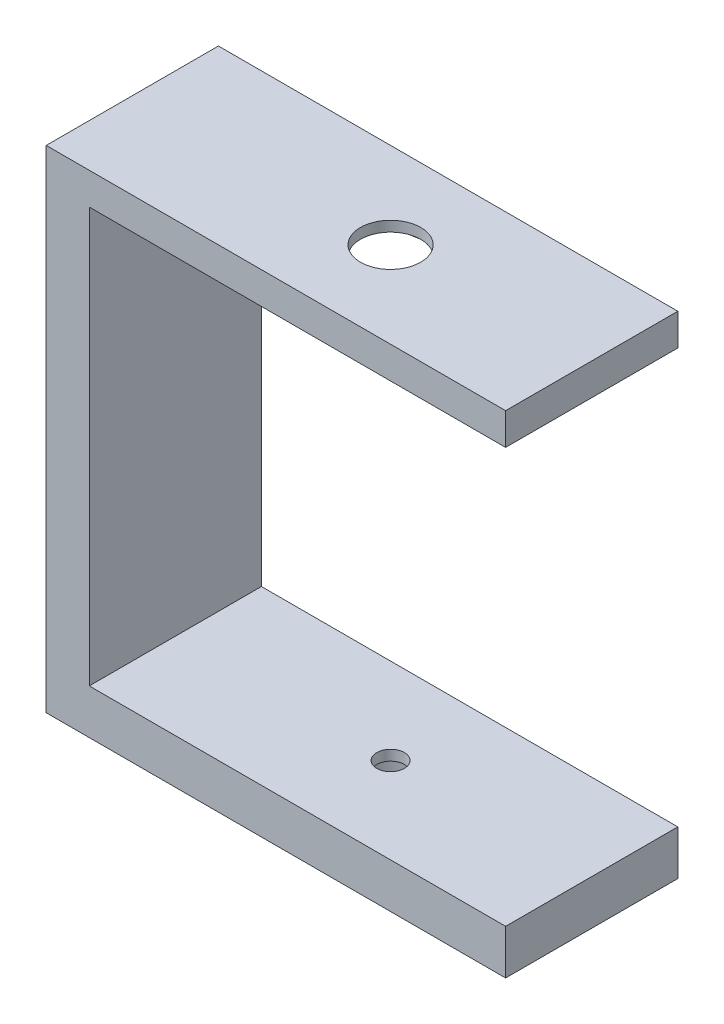
from build123d import *

# Parameters (mm, degrees)
CROQUIS1_W              = 53.36
CROQUIS1_H              = 20
SALIENTE_EXTRUIR1_DEPTH = 3.7
CROQUIS2_W              = 5
CROQUIS2_H              = 20
SALIENTE_EXTRUIR2_DEPTH = 48.17
CROQUIS3_W              = 53.36
CROQUIS3_H              = 20
SALIENTE_EXTRUIR3_DEPTH = 5.2
CORTAR_EXTRUIR1_DEPTH   = 2.5
CROQUIS5_R              = 3.5
CORTAR_EXTRUIR2_DEPTH   = 80.804426569
CROQUIS6_R              = 5
CORTAR_EXTRUIR3_DEPTH   = 4
CROQUIS7_R              = 1.6
CORTAR_EXTRUIR4_DEPTH   = 78.86985617


with BuildPart() as part:
    # Croquis1 → Saliente-Extruir1 (new body)
    with BuildSketch(Plane(origin=(0, 0, 0), x_dir=(1, 0, 0), z_dir=(0, 1, 0))):
        with Locations((26.68, 10)):
            Rectangle(CROQUIS1_W, CROQUIS1_H)
    extrude(amount=SALIENTE_EXTRUIR1_DEPTH)

    # Croquis2 → Saliente-Extruir2 (add)
    with BuildSketch(Plane.XZ):
        with Locations((2.5, -10)):
            Rectangle(CROQUIS2_W, CROQUIS2_H)
    extrude(amount=SALIENTE_EXTRUIR2_DEPTH)

    # Croquis3 → Saliente-Extruir3 (add)
    with BuildSketch(Plane.XZ.offset(48.17)):
        with Locations((26.68, -10)):
            Rectangle(CROQUIS3_W, CROQUIS3_H)
    extrude(amount=SALIENTE_EXTRUIR3_DEPTH)

    # Croquis4 → Cortar-Extruir1 (cut)
    with BuildSketch(Plane.XZ):
        with BuildLine():
            Line((28.897334072, -3.746470768), (13.839427952, -6.40158589))
            ThreePointArc((13.839427952, -6.40158589), (10.82, -10), (13.839427952, -13.59841411))
            Line((13.839427952, -13.59841411), (28.897334072, -16.253529232))
            ThreePointArc((28.897334072, -16.253529232), (29.446561034, -16.325836333), (30, -16.35))
            Line((30, -16.35), (30, -3.65))
            ThreePointArc((30, -3.65), (29.446561034, -3.674163667), (28.897334072, -3.746470768))
        make_face()
    cortar_extruir1 = extrude(amount=-CORTAR_EXTRUIR1_DEPTH, mode=Mode.SUBTRACT)

    # Simetría1: Cortar-Extruir1 across plane
    add(cortar_extruir1.mirror(Plane(origin=(30, 2.5, -3.65), x_dir=(0, 0, 1), z_dir=(1, 0, 0))), mode=Mode.SUBTRACT)

    # Croquis5 → Cortar-Extruir2 (cut, through all)
    with BuildSketch(Plane.XZ.offset(-2.5)):
        with Locations(Location((30, -10, 0), (0, 0, 270))):
            Circle(CROQUIS5_R)
    extrude(amount=-CORTAR_EXTRUIR2_DEPTH, mode=Mode.SUBTRACT)

    # Croquis6 → Cortar-Extruir3 (cut)
    with BuildSketch(Plane.XZ.offset(53.37)):
        with Locations(Location((30, -10, 0), (0, 0, 270))):
            Circle(CROQUIS6_R)
    extrude(amount=-CORTAR_EXTRUIR3_DEPTH, mode=Mode.SUBTRACT)

    # Croquis7 → Cortar-Extruir4 (cut, through all)
    with BuildSketch(Plane.XZ.offset(49.37)):
        with Locations(Location((30, -10, 0), (0, 0, 270))):
            Circle(CROQUIS7_R)
    extrude(amount=-CORTAR_EXTRUIR4_DEPTH, mode=Mode.SUBTRACT)


solid = part.part
